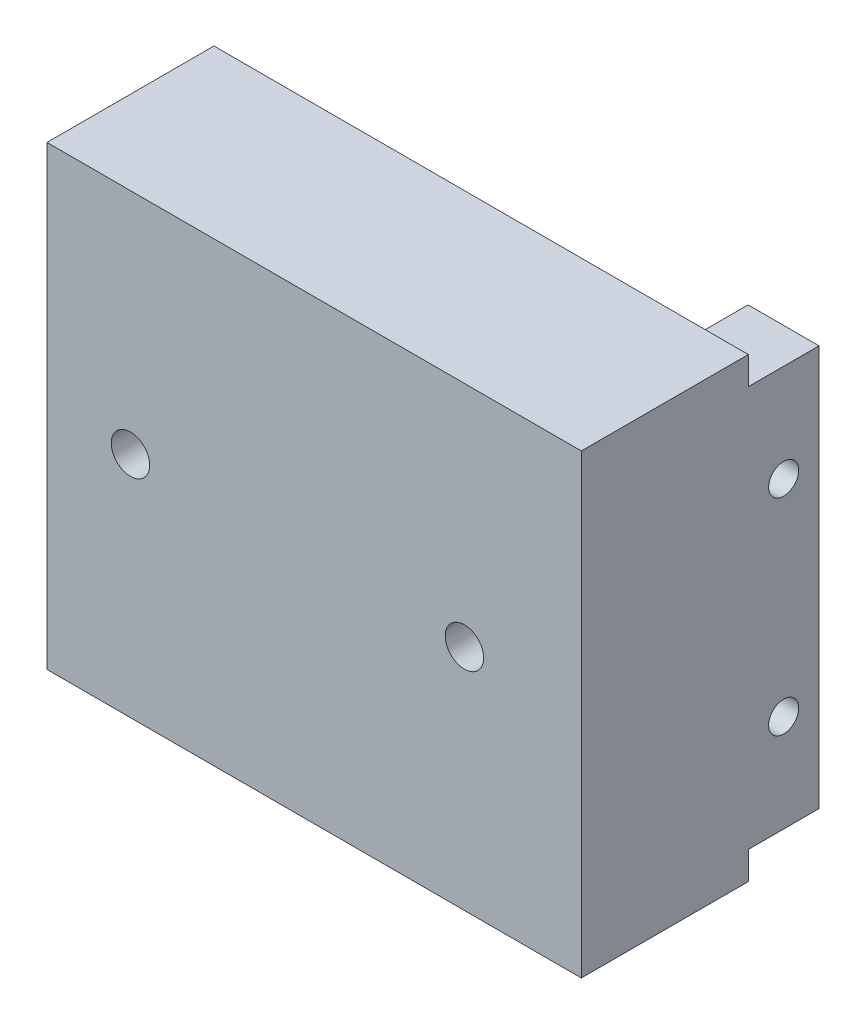
from build123d import *

# Parameters (mm, degrees)
SKETCH1_W                 = 48
SKETCH1_H                 = 41
BASE_EXTRUSION_DEPTH      = 15
SKETCH1_14_W              = 6.375
SKETCH1_14_H              = 36
CLEARANCE_EXTENSION_DEPTH = 6.35
F_8_32_TAPPED_HOLE6_D     = 3.4544
F_8_32_TAPPED_HOLE6_DEPTH = 13.96
F_8_32_TAPPED_HOLE6_TIP   = 1.037806461
F_6_32_TAPPED_HOLE1_D     = 2.7051


with BuildPart() as part:
    # Sketch1 → Base Extrusion (new body)
    with BuildSketch(Plane.XY):
        with Locations((1.5, 0)):
            Rectangle(SKETCH1_W, SKETCH1_H)
    extrude(amount=BASE_EXTRUSION_DEPTH)

    # Sketch1<14> → Clearance Extension (add)
    with BuildSketch(Plane.XY):
        with Locations((22.3125, 0)):
            Rectangle(SKETCH1_14_W, SKETCH1_14_H)
    extrude(amount=-CLEARANCE_EXTENSION_DEPTH)

    # #8-32 Tapped Hole6
    with Locations(Plane(origin=(15, 0, 15), x_dir=(1, 0, 0), z_dir=(0, 0, 1))):
        with Locations((0, 0), (-30, 0)):
            Hole(F_8_32_TAPPED_HOLE6_D / 2, depth=F_8_32_TAPPED_HOLE6_DEPTH)
            with Locations((0, 0, -(F_8_32_TAPPED_HOLE6_DEPTH + F_8_32_TAPPED_HOLE6_TIP / 2))):  # 118° drill point
                Cone(0, F_8_32_TAPPED_HOLE6_D / 2, F_8_32_TAPPED_HOLE6_TIP, mode=Mode.SUBTRACT)

    # #6-32 Tapped Hole1 (through all)
    with Locations(Plane(origin=(25.5, 0, 0), x_dir=(0, 0, -1), z_dir=(1, 0, 0))):
        with Locations((3.175, 9.25), (3.175, -9.25)):
            Hole(F_6_32_TAPPED_HOLE1_D / 2)


solid = part.part
